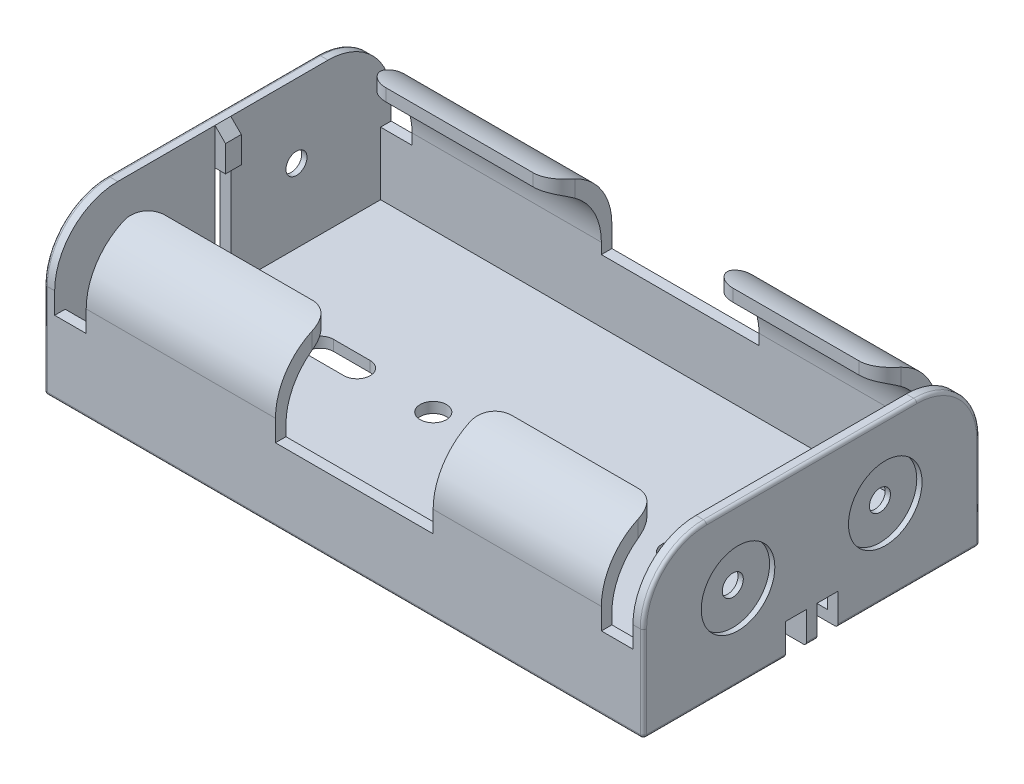
from build123d import *

# Parameters (mm, degrees)
MECHANICAL_OUTLINE_DEPTH = 55
CUT_EXTRUDE1_REACH       = 67.376
CUT_EXTRUDE2_REACH       = 67.376
SKETCH3_W                = 55
SKETCH3_H                = 21
SKETCH5_W                = 3
SKETCH5_H                = 32
SKETCH5_W_2              = 15
CUT_EXTRUDE3_DEPTH       = 8
BOSS_EXTRUDE2_DEPTH      = 1
BOSS_EXTRUDE3_START      = 1
BOSS_EXTRUDE3_DEPTH      = 1
SKETCH8_R                = 3.5
CUT_EXTRUDE4_DEPTH       = 0.5
CUT_EXTRUDE5_REACH       = 68.643
SKETCH9_R                = 1
CUT_EXTRUDE6_REACH       = 69.067
SKETCH10_W               = 1.5
SKETCH10_H               = 8
CUT_EXTRUDE7_REACH       = 68
SKETCH11_R               = 1.5
SKETCH11_R_2             = 1.25
CUT_EXTRUDE8_START       = -0.5
SKETCH12_R               = 3.5
CUT_EXTRUDE8_DEPTH       = 0.5
CUT_EXTRUDE9_REACH       = 68.643
SKETCH13_R               = 1
SKETCH15_W               = 2
SKETCH15_H               = 3
CUT_EXTRUDE10_DEPTH      = 3
CUT_EXTRUDE11_REACH      = 68.219
SKETCH16_W               = 1
SKETCH16_H               = 5
SKETCH17_W               = 1.5
SKETCH17_H               = 2.5
BOSS_EXTRUDE4_DEPTH      = 1
SKETCH18_W               = 1.5
SKETCH18_H               = 3.5
BOSS_EXTRUDE5_DEPTH      = 1
CHAMFER1_SIZE            = 1
SKETCH19_W               = 1
SKETCH19_H               = 5
BOSS_EXTRUDE6_DEPTH      = 1
FILLET2_R                = 2
FILLET3_R                = 0.3


with BuildPart() as part:
    # Sketch1 → Mechanical_Outline (new body)
    with BuildSketch(Plane(origin=(0, 0, 0), x_dir=(0, 0, -1), z_dir=(1, 0, 0))):
        with BuildLine():
            Line((0, 0), (-32, 0))
            Line((-32, 0), (-32, 9))
            ThreePointArc((-32, 9), (-30.242640687, 13.242640687), (-26, 15))
            Line((-26, 15), (-6, 15))
            ThreePointArc((-6, 15), (-1.757359313, 13.242640687), (0, 9))
            Line((0, 9), (0, 0))
        make_face()
    extrude(amount=MECHANICAL_OUTLINE_DEPTH)

    # Sketch2 → Cut-Extrude1 (cut, up to next)
    with BuildSketch(Plane(origin=(55, 0, 0), x_dir=(0, 0, -1), z_dir=(1, 0, 0)), mode=Mode.PRIVATE) as cut_extrude1_sk1:
        with BuildLine():
            Line((-25, 14), (-7, 14))
            ThreePointArc((-7, 14), (-2.757359313, 12.242640687), (-1, 8))
            Line((-1, 8), (-1, 1))
            Line((-1, 1), (-31, 1))
            Line((-31, 1), (-31, 8))
            ThreePointArc((-31, 8), (-29.242640687, 12.242640687), (-25, 14))
        make_face()
    cut_extrude1_tool1 = extrude(cut_extrude1_sk1.sketch, amount=-CUT_EXTRUDE1_REACH, mode=Mode.PRIVATE) & part.part
    add(cut_extrude1_tool1.solids().sort_by_distance((55, 7.287142, 16))[0], mode=Mode.SUBTRACT)

    # Sketch3 → Cut-Extrude2 (cut, up to next)
    with BuildSketch(Plane(origin=(0, 15, 0), x_dir=(1, 0, 0), z_dir=(0, 1, 0)), mode=Mode.PRIVATE) as cut_extrude2_sk1:
        with Locations((27.5, -16)):
            Rectangle(SKETCH3_W, SKETCH3_H)
    cut_extrude2_tool1 = extrude(cut_extrude2_sk1.sketch, amount=-CUT_EXTRUDE2_REACH, mode=Mode.PRIVATE) & part.part
    add(cut_extrude2_tool1.solids().sort_by_distance((27.5, 15, 16))[0], mode=Mode.SUBTRACT)

    # Sketch5 → Cut-Extrude3 (cut)
    with BuildSketch(Plane(origin=(0, 14.979130372, 0), x_dir=(1, 0, 0), z_dir=(0, 1, 0))):
        with Locations((1.5, -16)):
            Rectangle(SKETCH5_W, SKETCH5_H)
        with Locations((28.5, -16)):
            Rectangle(SKETCH5_W_2, SKETCH5_H)
        with Locations((53.5, -16)):
            Rectangle(SKETCH5_W, SKETCH5_H)
    extrude(amount=-CUT_EXTRUDE3_DEPTH, mode=Mode.SUBTRACT)

    # Sketch6 → Boss-Extrude2 (add)
    with BuildSketch(Plane(origin=(55, 0, 0), x_dir=(0, 0, -1), z_dir=(1, 0, 0))):
        with BuildLine():
            Line((-32, 0), (0, 0))
            Line((0, 0), (0, 9))
            ThreePointArc((0, 9), (-1.757359313, 13.242640687), (-6, 15))
            Line((-6, 15), (-26, 15))
            ThreePointArc((-26, 15), (-30.242640687, 13.242640687), (-32, 9))
            Line((-32, 9), (-32, 0))
        make_face()
    extrude(amount=BOSS_EXTRUDE2_DEPTH)

    # Sketch7 → Boss-Extrude3 (add)
    with BuildSketch(Plane.ZY.offset(BOSS_EXTRUDE3_START)):
        with BuildLine():
            Line((0, 0), (32, 0))
            Line((32, 0), (32, 9))
            ThreePointArc((32, 9), (30.242640687, 13.242640687), (26, 15))
            Line((26, 15), (6, 15))
            ThreePointArc((6, 15), (1.757359313, 13.242640687), (0, 9))
            Line((0, 9), (0, 0))
        make_face()
    extrude(amount=-BOSS_EXTRUDE3_DEPTH)

    # Sketch8 → Cut-Extrude4 (cut)
    with BuildSketch(Plane.ZY.offset(1)):
        with Locations((9, 8)):
            Circle(SKETCH8_R)
        with Locations((23, 8)):
            Circle(SKETCH8_R)
    extrude(amount=-CUT_EXTRUDE4_DEPTH, mode=Mode.SUBTRACT)

    # Sketch9 → Cut-Extrude5 (cut, up to next)
    with BuildSketch(Plane.ZY.offset(0.5), mode=Mode.PRIVATE) as cut_extrude5_sk1:
        with Locations((9, 8)):
            Circle(SKETCH9_R)
    cut_extrude5_tool1 = extrude(cut_extrude5_sk1.sketch, amount=-CUT_EXTRUDE5_REACH, mode=Mode.PRIVATE) & part.part
    # Sketch9 → Cut-Extrude5 (cut, up to next)
    with BuildSketch(Plane.ZY.offset(0.5), mode=Mode.PRIVATE) as cut_extrude5_sk2:
        with Locations((23, 8)):
            Circle(SKETCH9_R)
    cut_extrude5_tool2 = extrude(cut_extrude5_sk2.sketch, amount=-CUT_EXTRUDE5_REACH, mode=Mode.PRIVATE) & part.part
    add(cut_extrude5_tool1.solids().sort_by_distance((-0.5, 8, 9))[0], mode=Mode.SUBTRACT)
    add(cut_extrude5_tool2.solids().sort_by_distance((-0.5, 8, 23))[0], mode=Mode.SUBTRACT)

    # Sketch10 → Cut-Extrude6 (cut, up to next)
    with BuildSketch(Plane.ZY.offset(1), mode=Mode.PRIVATE) as cut_extrude6_sk1:
        with Locations((16, 7.5)):
            Rectangle(SKETCH10_W, SKETCH10_H)
    cut_extrude6_tool1 = extrude(cut_extrude6_sk1.sketch, amount=-CUT_EXTRUDE6_REACH, mode=Mode.PRIVATE) & part.part
    add(cut_extrude6_tool1.solids().sort_by_distance((-1, 7.5, 16))[0], mode=Mode.SUBTRACT)

    # Sketch11 → Cut-Extrude7 (cut, up to next)
    with BuildSketch(Plane(origin=(0, 1, 0), x_dir=(1, 0, 0), z_dir=(0, 1, 0)), mode=Mode.PRIVATE) as cut_extrude7_sk1:
        with Locations(Location((27, -16, 0), (0, 0, 270))):
            Circle(SKETCH11_R)
    cut_extrude7_tool1 = extrude(cut_extrude7_sk1.sketch, amount=-CUT_EXTRUDE7_REACH, mode=Mode.PRIVATE) & part.part
    # Sketch11 → Cut-Extrude7 (cut, up to next)
    with BuildSketch(Plane(origin=(0, 1, 0), x_dir=(1, 0, 0), z_dir=(0, 1, 0)), mode=Mode.PRIVATE) as cut_extrude7_sk2:
        with Locations(Location((20, -15.986978749, 0), (0, 0, 270))):
            Circle(SKETCH11_R_2)
    cut_extrude7_tool2 = extrude(cut_extrude7_sk2.sketch, amount=-CUT_EXTRUDE7_REACH, mode=Mode.PRIVATE) & part.part
    # Sketch11 → Cut-Extrude7 (cut, up to next)
    with BuildSketch(Plane(origin=(0, 1, 0), x_dir=(1, 0, 0), z_dir=(0, 1, 0)), mode=Mode.PRIVATE) as cut_extrude7_sk3:
        with Locations(Location((34, -16, 0), (0, 0, 270))):
            Circle(SKETCH11_R_2)
    cut_extrude7_tool3 = extrude(cut_extrude7_sk3.sketch, amount=-CUT_EXTRUDE7_REACH, mode=Mode.PRIVATE) & part.part
    # Sketch11 → Cut-Extrude7 (cut, up to next)
    with BuildSketch(Plane(origin=(0, 1, 0), x_dir=(1, 0, 0), z_dir=(0, 1, 0)), mode=Mode.PRIVATE) as cut_extrude7_sk4:
        with Locations(Location((43, -15.986978749, 0), (0, 0, 270))):
            Circle(SKETCH11_R_2)
    cut_extrude7_tool4 = extrude(cut_extrude7_sk4.sketch, amount=-CUT_EXTRUDE7_REACH, mode=Mode.PRIVATE) & part.part
    # Sketch11 → Cut-Extrude7 (cut, up to next)
    with BuildSketch(Plane(origin=(0, 1, 0), x_dir=(1, 0, 0), z_dir=(0, 1, 0)), mode=Mode.PRIVATE) as cut_extrude7_sk5:
        with BuildLine():
            Line((9.25, -14.736978749), (12.75, -14.736978749))
            ThreePointArc((12.75, -14.736978749), (14, -15.986978749), (12.75, -17.236978749))
            Line((12.75, -17.236978749), (9.25, -17.236978749))
            ThreePointArc((9.25, -17.236978749), (8, -15.986978749), (9.25, -14.736978749))
        make_face()
    cut_extrude7_tool5 = extrude(cut_extrude7_sk5.sketch, amount=-CUT_EXTRUDE7_REACH, mode=Mode.PRIVATE) & part.part
    add(cut_extrude7_tool1.solids().sort_by_distance((27, 1, 16))[0], mode=Mode.SUBTRACT)
    add(cut_extrude7_tool2.solids().sort_by_distance((20, 1, 15.986979))[0], mode=Mode.SUBTRACT)
    add(cut_extrude7_tool3.solids().sort_by_distance((34, 1, 16))[0], mode=Mode.SUBTRACT)
    add(cut_extrude7_tool4.solids().sort_by_distance((43, 1, 15.986979))[0], mode=Mode.SUBTRACT)
    add(cut_extrude7_tool5.solids().sort_by_distance((11, 1, 15.986979))[0], mode=Mode.SUBTRACT)

    # Sketch12 → Cut-Extrude8 (cut)
    with BuildSketch(Plane(origin=(56, 0, 0), x_dir=(0, 0, -1), z_dir=(1, 0, 0)).offset(CUT_EXTRUDE8_START)):
        with Locations(Location((-23, 8, 0), (0, 0, 180))):
            Circle(SKETCH12_R)
        with Locations(Location((-9, 8, 0), (0, 0, 180))):
            Circle(SKETCH12_R)
    extrude(amount=CUT_EXTRUDE8_DEPTH, mode=Mode.SUBTRACT)

    # Sketch13 → Cut-Extrude9 (cut, up to next)
    with BuildSketch(Plane(origin=(55.5, 0, 0), x_dir=(0, 0, -1), z_dir=(1, 0, 0)), mode=Mode.PRIVATE) as cut_extrude9_sk1:
        with Locations(Location((-23, 8, 0), (0, 0, 180))):
            Circle(SKETCH13_R)
    cut_extrude9_tool1 = extrude(cut_extrude9_sk1.sketch, amount=-CUT_EXTRUDE9_REACH, mode=Mode.PRIVATE) & part.part
    # Sketch13 → Cut-Extrude9 (cut, up to next)
    with BuildSketch(Plane(origin=(55.5, 0, 0), x_dir=(0, 0, -1), z_dir=(1, 0, 0)), mode=Mode.PRIVATE) as cut_extrude9_sk2:
        with Locations(Location((-9, 8, 0), (0, 0, 180))):
            Circle(SKETCH13_R)
    cut_extrude9_tool2 = extrude(cut_extrude9_sk2.sketch, amount=-CUT_EXTRUDE9_REACH, mode=Mode.PRIVATE) & part.part
    add(cut_extrude9_tool1.solids().sort_by_distance((55.5, 8, 23))[0], mode=Mode.SUBTRACT)
    add(cut_extrude9_tool2.solids().sort_by_distance((55.5, 8, 9))[0], mode=Mode.SUBTRACT)

    # Sketch15 → Cut-Extrude10 (cut)
    with BuildSketch(Plane(origin=(56, 0, 0), x_dir=(0, 0, -1), z_dir=(1, 0, 0))):
        with Locations((-17.5, 1.5)):
            Rectangle(SKETCH15_W, SKETCH15_H)
        with Locations((-14.5, 1.5)):
            Rectangle(SKETCH15_W, SKETCH15_H)
    extrude(amount=-CUT_EXTRUDE10_DEPTH, mode=Mode.SUBTRACT)

    # Sketch16 → Cut-Extrude11 (cut, up to next)
    with BuildSketch(Plane.XZ, mode=Mode.PRIVATE) as cut_extrude11_sk1:
        with Locations((54.5, 23)):
            Rectangle(SKETCH16_W, SKETCH16_H)
    cut_extrude11_tool1 = extrude(cut_extrude11_sk1.sketch, amount=-CUT_EXTRUDE11_REACH, mode=Mode.PRIVATE) & part.part
    # Sketch16 → Cut-Extrude11 (cut, up to next)
    with BuildSketch(Plane.XZ, mode=Mode.PRIVATE) as cut_extrude11_sk2:
        with Locations((54.5, 9)):
            Rectangle(SKETCH16_W, SKETCH16_H)
    cut_extrude11_tool2 = extrude(cut_extrude11_sk2.sketch, amount=-CUT_EXTRUDE11_REACH, mode=Mode.PRIVATE) & part.part
    add(cut_extrude11_tool1.solids().sort_by_distance((54.5, 0, 23))[0], mode=Mode.SUBTRACT)
    add(cut_extrude11_tool2.solids().sort_by_distance((54.5, 0, 9))[0], mode=Mode.SUBTRACT)

    # Sketch17 → Boss-Extrude4 (add)
    with BuildSketch(Plane(origin=(0, 0, 0), x_dir=(0, 0, -1), z_dir=(1, 0, 0))):
        with Locations((-16, 2.25)):
            Rectangle(SKETCH17_W, SKETCH17_H)
    extrude(amount=BOSS_EXTRUDE4_DEPTH)

    # Sketch18 → Boss-Extrude5 (add)
    with BuildSketch(Plane(origin=(0, 0, 0), x_dir=(0, 0, -1), z_dir=(1, 0, 0))):
        with Locations((-16, 13.25)):
            Rectangle(SKETCH18_W, SKETCH18_H)
    extrude(amount=BOSS_EXTRUDE5_DEPTH)

    # Chamfer1
    chamfer1_edges = [part.edges().sort_by_distance(p)[0] for p in [
        (1, 15, 16),
    ]]
    chamfer(chamfer1_edges, length=CHAMFER1_SIZE)

    # Sketch19 → Boss-Extrude6 (add)
    with BuildSketch(Plane.ZY.offset(-55)):
        with Locations((16, 3.5)):
            Rectangle(SKETCH19_W, SKETCH19_H)
    extrude(amount=BOSS_EXTRUDE6_DEPTH)

    # Fillet2
    fillet2_edges = [part.edges().sort_by_distance(p)[0] for p in [
        (21, 14.394302695, 5.5),
        (36, 14.394302695, 5.5),
        (52, 14.394302695, 26.5),
        (52, 14.394302695, 5.5),
        (3, 14.394302695, 26.5),
        (3, 14.394302695, 5.5),
        (36, 14.394302695, 26.5),
        (21, 14.394302695, 26.5),
    ]]
    fillet(fillet2_edges, radius=FILLET2_R)

    # Fillet3
    fillet3_edges = [part.edges().sort_by_distance(p)[0] for p in [
        (27.5, 0, 0),
        (27.5, 0, 32),
        (56, 4.5, 32),
        (56, 0, 25.25),
        (56, 4.5, 0),
        (56, 13.242640687, 1.757359313),
        (56, 15, 16),
        (56, 13.242640687, 30.242640687),
        (-1, 4.5, 0),
        (-1, 0, 16),
        (-1, 4.5, 32),
        (-1, 13.242640687, 30.242640687),
        (-1, 15, 16),
        (-1, 13.242640687, 1.757359313),
        (56, 0, 16),
        (56, 0, 6.75),
    ]]
    fillet(fillet3_edges, radius=FILLET3_R)


solid = part.part
